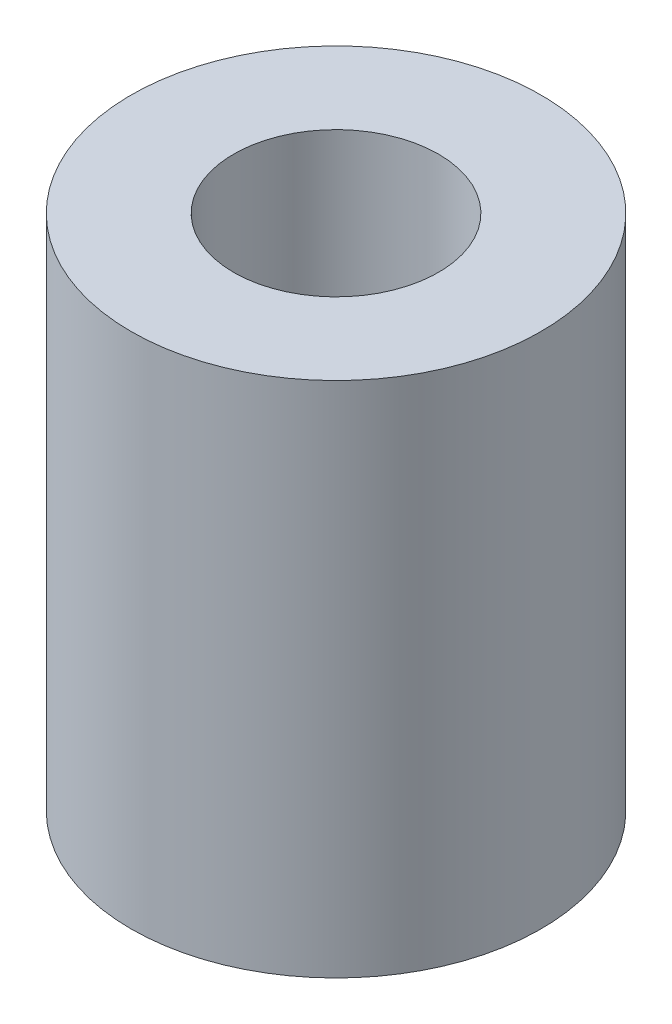
from build123d import *

# Parameters (mm, degrees)
SKETCH2_R           = 2
SKETCH2_R_2         = 1
BOSS_EXTRUDE1_DEPTH = 5.05


with BuildPart() as part:
    # Sketch2 → Boss-Extrude1 (new body)
    with BuildSketch(Plane(origin=(0, 0, 0), x_dir=(1, 0, 0), z_dir=(0, 1, 0))):
        with Locations(Location((0, 0, 0), (0, 0, 270))):
            Circle(SKETCH2_R)
        with Locations(Location((0, 0, 0), (0, 0, 270))):
            Circle(SKETCH2_R_2, mode=Mode.SUBTRACT)
    extrude(amount=BOSS_EXTRUDE1_DEPTH)


solid = part.part
